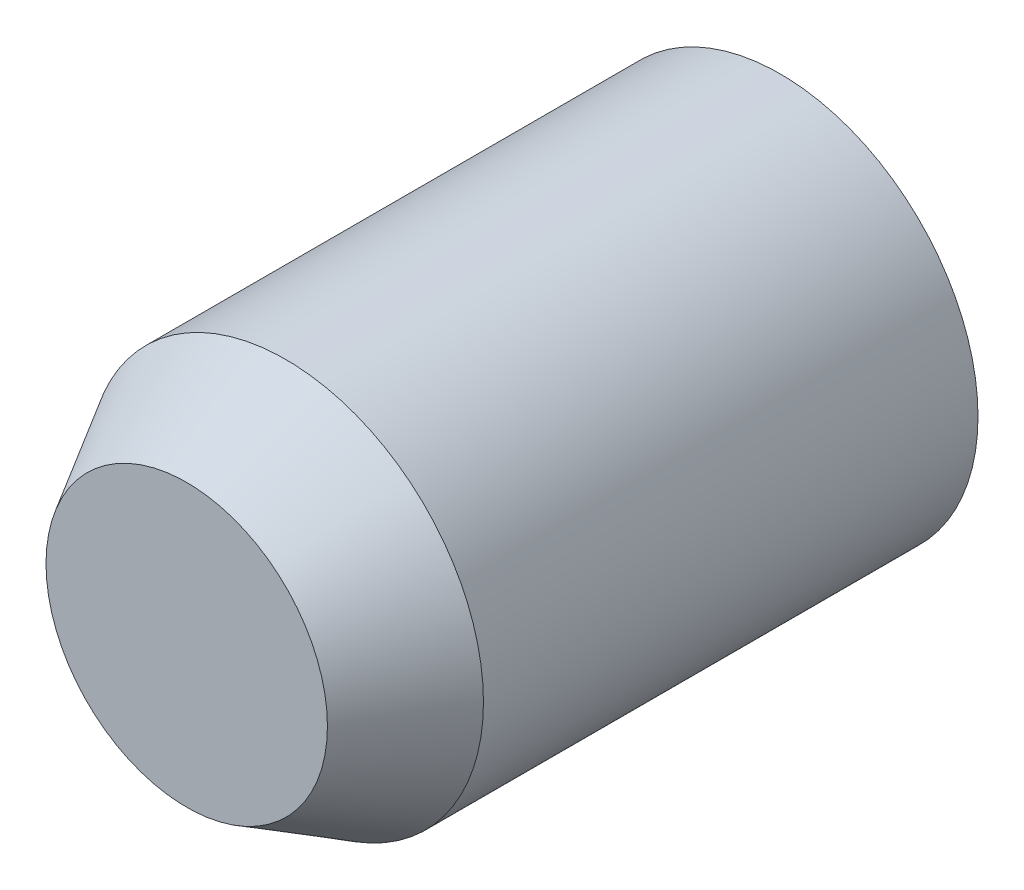
from build123d import *

# Parameters (mm, degrees)
SKETCH1_R           = 1
BOSS_EXTRUDE1_DEPTH = 3
CHAMFER1_SIZE       = 0.5
CHAMFER1_SIZE2      = 0.288675135
CUT_EXTRUDE1_DEPTH  = 1


with BuildPart() as part:
    # Sketch1 → Boss-Extrude1 (new body)
    with BuildSketch(Plane.XY):
        Circle(SKETCH1_R)
    extrude(amount=BOSS_EXTRUDE1_DEPTH)

    # Chamfer1
    chamfer1_edges = [part.edges().sort_by_distance(p)[0] for p in [
        (-1, 0, 3),
    ]]
    chamfer1_side = [part.faces().sort_by_distance(p)[0] for p in [
        (-1, 0, 1.5),
    ]]
    chamfer(chamfer1_edges, length=CHAMFER1_SIZE, length2=CHAMFER1_SIZE2, reference=chamfer1_side[0])

    # Sketch2 → Cut-Extrude1 (cut)
    with BuildSketch(Plane(origin=(0, 0, 0), x_dir=(-1, 0, 0), z_dir=(0, 0, -1))):
        Polygon((0.808290377, 0), (0.404145188, 0.7), (-0.404145188, 0.7), (-0.808290377, 0), (-0.404145188, -0.7), (0.404145188, -0.7), align=None)
    extrude(amount=-CUT_EXTRUDE1_DEPTH, mode=Mode.SUBTRACT)


solid = part.part
